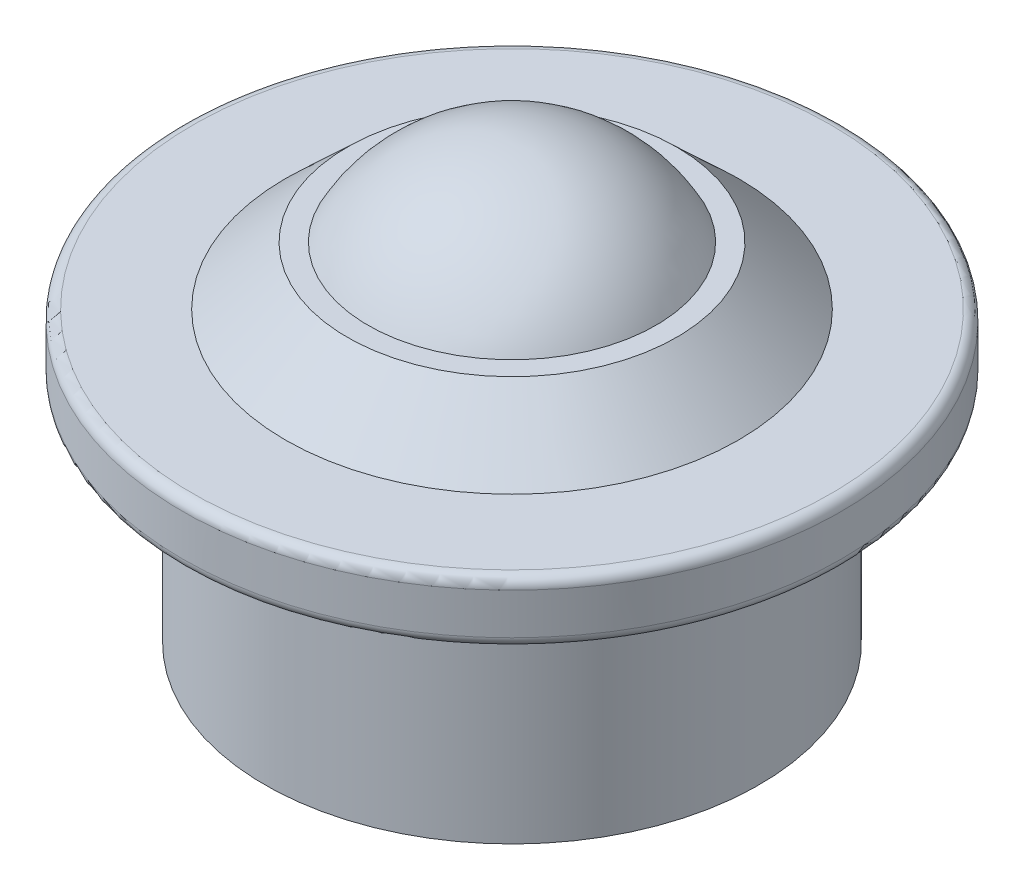
from build123d import *

# Parameters (mm, degrees)
CONG_1_R = 0.5


with BuildPart() as part:
    # Esquisse1 → Révolution1 (revolve)
    with BuildSketch(Plane.XY, mode=Mode.PRIVATE) as r_volution1_sk:
        with BuildLine():
            Line((0, 0), (-12, 0))
            Line((-12, 0), (-12, 11))
            Line((-12, 11), (-16, 11))
            Line((-16, 11), (-16, 14))
            Line((-16, 14), (-11, 14))
            Line((-11, 14), (-8, 16.821458712))
            Line((-8, 16.821458712), (-6.992498005, 16.821458712))
            ThreePointArc((-6.992498005, 16.821458712), (-4.072936154, 19.875775164), (0, 21))
            Line((0, 21), (0, 0))
        make_face()
    revolve(r_volution1_sk.sketch.rotate(Axis((0, 0, 0), (0, 1, 0)), 270), axis=Axis((0, 0, 0), (0, 1, 0)))

    # Congé1
    cong_1_edges = [part.edges().sort_by_distance(p)[0] for p in [
        (0, 11, 16),
        (0, 14, 16),
    ]]
    fillet(cong_1_edges, radius=CONG_1_R)


solid = part.part
